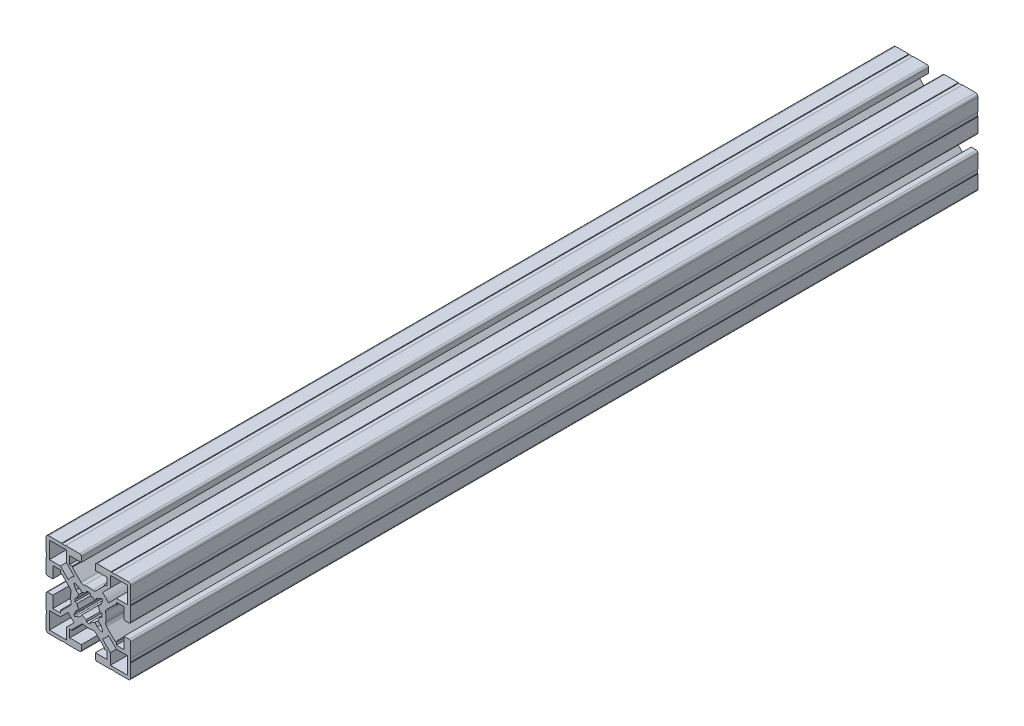
from build123d import *

# Parameters (mm, degrees)
RESSALTO_EXTRUS_O1_DEPTH = 500


with BuildPart() as part:
    # Model → Ressalto-extrusão1 (new body)
    with BuildSketch(Plane.XY):
        with BuildLine():
            Line((-23.5, -25), (-15.8, -25))
            Line((-15.8, -25), (-15.6, -24.8))
            Line((-15.6, -24.8), (-13.6, -24.8))
            Line((-13.6, -24.8), (-13.4, -25))
            Line((-13.4, -25), (-5.15, -25))
            ThreePointArc((-5.15, -25), (-4.442893219, -24.707106781), (-4.15, -24))
            Line((-4.15, -24), (-4.15, -21))
            Line((-4.15, -21), (-11, -21))
            Line((-11, -21), (-11, -16.463961031))
            Line((-11, -16.463961031), (-9.5, -16.463961031))
            Line((-9.5, -16.463961031), (-9.5, -15.863961031))
            Line((-9.5, -15.863961031), (-4.36785392, -10.731814951))
            ThreePointArc((-4.36785392, -10.731814951), (-3.493702835, -10.220325389), (-2.4810579, -10.202663951))
            ThreePointArc((-2.4810579, -10.202663951), (0, -10.5), (2.4810579, -10.202663951))
            ThreePointArc((2.4810579, -10.202663951), (3.493702835, -10.220325389), (4.36785392, -10.731814951))
            Line((4.36785392, -10.731814951), (9.5, -15.863961031))
            Line((9.5, -15.863961031), (9.5, -16.463961031))
            Line((9.5, -16.463961031), (11, -16.463961031))
            Line((11, -16.463961031), (11, -21))
            Line((11, -21), (4.15, -21))
            Line((4.15, -21), (4.15, -24))
            ThreePointArc((4.15, -24), (4.442893219, -24.707106781), (5.15, -25))
            Line((5.15, -25), (13.4, -25))
            Line((13.4, -25), (13.6, -24.8))
            Line((13.6, -24.8), (15.6, -24.8))
            Line((15.6, -24.8), (15.8, -25))
            Line((15.8, -25), (23.5, -25))
            ThreePointArc((23.5, -25), (24.560660172, -24.560660172), (25, -23.5))
            Line((25, -23.5), (25, -15.8))
            Line((25, -15.8), (24.8, -15.6))
            Line((24.8, -15.6), (24.8, -13.6))
            Line((24.8, -13.6), (25, -13.4))
            Line((25, -13.4), (25, -5.15))
            ThreePointArc((25, -5.15), (24.707106781, -4.442893219), (24, -4.15))
            Line((24, -4.15), (21, -4.15))
            Line((21, -4.15), (21, -11))
            Line((21, -11), (16.463961031, -11))
            Line((16.463961031, -11), (16.463961031, -9.5))
            Line((16.463961031, -9.5), (15.863961031, -9.5))
            Line((15.863961031, -9.5), (10.731814951, -4.36785392))
            ThreePointArc((10.731814951, -4.36785392), (10.220325389, -3.493702835), (10.202663951, -2.4810579))
            ThreePointArc((10.202663951, -2.4810579), (10.5, 0), (10.202663951, 2.4810579))
            ThreePointArc((10.202663951, 2.4810579), (10.220325389, 3.493702835), (10.731814951, 4.36785392))
            Line((10.731814951, 4.36785392), (15.863961031, 9.5))
            Line((15.863961031, 9.5), (16.463961031, 9.5))
            Line((16.463961031, 9.5), (16.463961031, 11))
            Line((16.463961031, 11), (21, 11))
            Line((21, 11), (21, 4.15))
            Line((21, 4.15), (24, 4.15))
            ThreePointArc((24, 4.15), (24.707106781, 4.442893219), (25, 5.15))
            Line((25, 5.15), (25, 13.4))
            Line((25, 13.4), (24.8, 13.6))
            Line((24.8, 13.6), (24.8, 15.6))
            Line((24.8, 15.6), (25, 15.8))
            Line((25, 15.8), (25, 23.5))
            ThreePointArc((25, 23.5), (24.560660172, 24.560660172), (23.5, 25))
            Line((23.5, 25), (15.8, 25))
            Line((15.8, 25), (15.6, 24.8))
            Line((15.6, 24.8), (13.6, 24.8))
            Line((13.6, 24.8), (13.4, 25))
            Line((13.4, 25), (5.15, 25))
            ThreePointArc((5.15, 25), (4.442893219, 24.707106781), (4.15, 24))
            Line((4.15, 24), (4.15, 21))
            Line((4.15, 21), (11, 21))
            Line((11, 21), (11, 16.463961031))
            Line((11, 16.463961031), (9.5, 16.463961031))
            Line((9.5, 16.463961031), (9.5, 15.863961031))
            Line((9.5, 15.863961031), (4.36785392, 10.731814951))
            ThreePointArc((4.36785392, 10.731814951), (3.493702835, 10.220325389), (2.4810579, 10.202663951))
            ThreePointArc((2.4810579, 10.202663951), (0, 10.5), (-2.4810579, 10.202663951))
            ThreePointArc((-2.4810579, 10.202663951), (-3.493702835, 10.220325389), (-4.36785392, 10.731814951))
            Line((-4.36785392, 10.731814951), (-9.5, 15.863961031))
            Line((-9.5, 15.863961031), (-9.5, 16.463961031))
            Line((-9.5, 16.463961031), (-11, 16.463961031))
            Line((-11, 16.463961031), (-11, 21))
            Line((-11, 21), (-4.15, 21))
            Line((-4.15, 21), (-4.15, 24))
            ThreePointArc((-4.15, 24), (-4.442893219, 24.707106781), (-5.15, 25))
            Line((-5.15, 25), (-13.4, 25))
            Line((-13.4, 25), (-13.6, 24.8))
            Line((-13.6, 24.8), (-15.6, 24.8))
            Line((-15.6, 24.8), (-15.8, 25))
            Line((-15.8, 25), (-23.5, 25))
            ThreePointArc((-23.5, 25), (-24.560660172, 24.560660172), (-25, 23.5))
            Line((-25, 23.5), (-25, 15.8))
            Line((-25, 15.8), (-24.8, 15.6))
            Line((-24.8, 15.6), (-24.8, 13.6))
            Line((-24.8, 13.6), (-25, 13.4))
            Line((-25, 13.4), (-25, 5.15))
            ThreePointArc((-25, 5.15), (-24.707106781, 4.442893219), (-24, 4.15))
            Line((-24, 4.15), (-21, 4.15))
            Line((-21, 4.15), (-21, 11))
            Line((-21, 11), (-16.463961031, 11))
            Line((-16.463961031, 11), (-16.463961031, 9.5))
            Line((-16.463961031, 9.5), (-15.863961031, 9.5))
            Line((-15.863961031, 9.5), (-10.731814951, 4.36785392))
            ThreePointArc((-10.731814951, 4.36785392), (-10.220325389, 3.493702835), (-10.202663951, 2.4810579))
            ThreePointArc((-10.202663951, 2.4810579), (-10.5, 0), (-10.202663951, -2.4810579))
            ThreePointArc((-10.202663951, -2.4810579), (-10.220325389, -3.493702835), (-10.731814951, -4.36785392))
            Line((-10.731814951, -4.36785392), (-15.863961031, -9.5))
            Line((-15.863961031, -9.5), (-16.463961031, -9.5))
            Line((-16.463961031, -9.5), (-16.463961031, -11))
            Line((-16.463961031, -11), (-21, -11))
            Line((-21, -11), (-21, -4.15))
            Line((-21, -4.15), (-24, -4.15))
            ThreePointArc((-24, -4.15), (-24.707106781, -4.442893219), (-25, -5.15))
            Line((-25, -5.15), (-25, -13.4))
            Line((-25, -13.4), (-24.8, -13.6))
            Line((-24.8, -13.6), (-24.8, -15.6))
            Line((-24.8, -15.6), (-25, -15.8))
            Line((-25, -15.8), (-25, -23.5))
            ThreePointArc((-25, -23.5), (-24.560660172, -24.560660172), (-23.5, -25))
        make_face()
        with BuildLine():
            Line((11.867271891, 8.331737985), (16.535533906, 13))
            Line((16.535533906, 13), (23, 13))
            Line((23, 13), (23, 23))
            Line((23, 23), (13, 23))
            Line((13, 23), (13, 16.535533906))
            Line((13, 16.535533906), (8.331737985, 11.867271891))
            ThreePointArc((8.331737985, 11.867271891), (10.253048327, 10.253048327), (11.867271891, 8.331737985))
        make_face(mode=Mode.SUBTRACT)
        with BuildLine():
            Line((-13, 23), (-13, 16.535533906))
            Line((-13, 16.535533906), (-8.331737985, 11.867271891))
            ThreePointArc((-8.331737985, 11.867271891), (-10.253048327, 10.253048327), (-11.867271891, 8.331737985))
            Line((-11.867271891, 8.331737985), (-16.535533906, 13))
            Line((-16.535533906, 13), (-23, 13))
            Line((-23, 13), (-23, 23))
            Line((-23, 23), (-13, 23))
        make_face(mode=Mode.SUBTRACT)
        with BuildLine():
            Line((-13, -23), (-23, -23))
            Line((-23, -23), (-23, -13))
            Line((-23, -13), (-16.535533906, -13))
            Line((-16.535533906, -13), (-11.867271891, -8.331737985))
            ThreePointArc((-11.867271891, -8.331737985), (-10.253048327, -10.253048327), (-8.331737985, -11.867271891))
            Line((-8.331737985, -11.867271891), (-13, -16.535533906))
            Line((-13, -16.535533906), (-13, -23))
        make_face(mode=Mode.SUBTRACT)
        with BuildLine():
            Line((8.331737985, -11.867271891), (13, -16.535533906))
            Line((13, -16.535533906), (13, -23))
            Line((13, -23), (23, -23))
            Line((23, -23), (23, -13))
            Line((23, -13), (16.535533906, -13))
            Line((16.535533906, -13), (11.867271891, -8.331737985))
            ThreePointArc((11.867271891, -8.331737985), (10.253048327, -10.253048327), (8.331737985, -11.867271891))
        make_face(mode=Mode.SUBTRACT)
        with BuildLine():
            Line((-7.769449291, -8.422730773), (-5.188685539, -7.353743426))
            Line((-5.188685539, -7.353743426), (-3.878468883, -5.646235836))
            ThreePointArc((-3.878468883, -5.646235836), (-2.621381512, -6.328574798), (-1.25, -6.734983296))
            Line((-1.25, -6.734983296), (-1.093339775, -7.924935844))
            ThreePointArc((-1.093339775, -7.924935844), (0, -8), (1.093339775, -7.924935844))
            Line((1.093339775, -7.924935844), (1.25, -6.734983296))
            ThreePointArc((1.25, -6.734983296), (2.621381512, -6.328574798), (3.878468883, -5.646235836))
            Line((3.878468883, -5.646235836), (5.188685539, -7.353743426))
            Line((5.188685539, -7.353743426), (7.769449291, -8.422730773))
            ThreePointArc((7.769449291, -8.422730773), (8.314344398, -8.314344398), (8.422730773, -7.769449291))
            Line((8.422730773, -7.769449291), (7.353743426, -5.188685539))
            Line((7.353743426, -5.188685539), (5.646235836, -3.878468883))
            ThreePointArc((5.646235836, -3.878468883), (6.328574798, -2.621381512), (6.734983296, -1.25))
            Line((6.734983296, -1.25), (7.924935844, -1.093339775))
            ThreePointArc((7.924935844, -1.093339775), (8, 0), (7.924935844, 1.093339775))
            Line((7.924935844, 1.093339775), (6.734983296, 1.25))
            ThreePointArc((6.734983296, 1.25), (6.328574798, 2.621381512), (5.646235836, 3.878468883))
            Line((5.646235836, 3.878468883), (7.353743426, 5.188685539))
            Line((7.353743426, 5.188685539), (8.422730773, 7.769449291))
            ThreePointArc((8.422730773, 7.769449291), (8.314344398, 8.314344398), (7.769449291, 8.422730773))
            Line((7.769449291, 8.422730773), (5.188685539, 7.353743426))
            Line((5.188685539, 7.353743426), (3.878468883, 5.646235836))
            ThreePointArc((3.878468883, 5.646235836), (2.621381512, 6.328574798), (1.25, 6.734983296))
            Line((1.25, 6.734983296), (1.093339775, 7.924935844))
            ThreePointArc((1.093339775, 7.924935844), (0, 8), (-1.093339775, 7.924935844))
            Line((-1.093339775, 7.924935844), (-1.25, 6.734983296))
            ThreePointArc((-1.25, 6.734983296), (-2.621381512, 6.328574798), (-3.878468883, 5.646235836))
            Line((-3.878468883, 5.646235836), (-5.188685539, 7.353743426))
            Line((-5.188685539, 7.353743426), (-7.769449291, 8.422730773))
            ThreePointArc((-7.769449291, 8.422730773), (-8.314344398, 8.314344398), (-8.422730773, 7.769449291))
            Line((-8.422730773, 7.769449291), (-7.353743426, 5.188685539))
            Line((-7.353743426, 5.188685539), (-5.646235836, 3.878468883))
            ThreePointArc((-5.646235836, 3.878468883), (-6.328574798, 2.621381512), (-6.734983296, 1.25))
            Line((-6.734983296, 1.25), (-7.924935844, 1.093339775))
            ThreePointArc((-7.924935844, 1.093339775), (-8, 0), (-7.924935844, -1.093339775))
            Line((-7.924935844, -1.093339775), (-6.734983296, -1.25))
            ThreePointArc((-6.734983296, -1.25), (-6.328574798, -2.621381512), (-5.646235836, -3.878468883))
            Line((-5.646235836, -3.878468883), (-7.353743426, -5.188685539))
            Line((-7.353743426, -5.188685539), (-8.422730773, -7.769449291))
            ThreePointArc((-8.422730773, -7.769449291), (-8.451183647, -8.058336168), (-8.314344398, -8.314344398))
            ThreePointArc((-8.314344398, -8.314344398), (-8.058336168, -8.451183647), (-7.769449291, -8.422730773))
        make_face(mode=Mode.SUBTRACT)
    extrude(amount=RESSALTO_EXTRUS_O1_DEPTH)


solid = part.part
